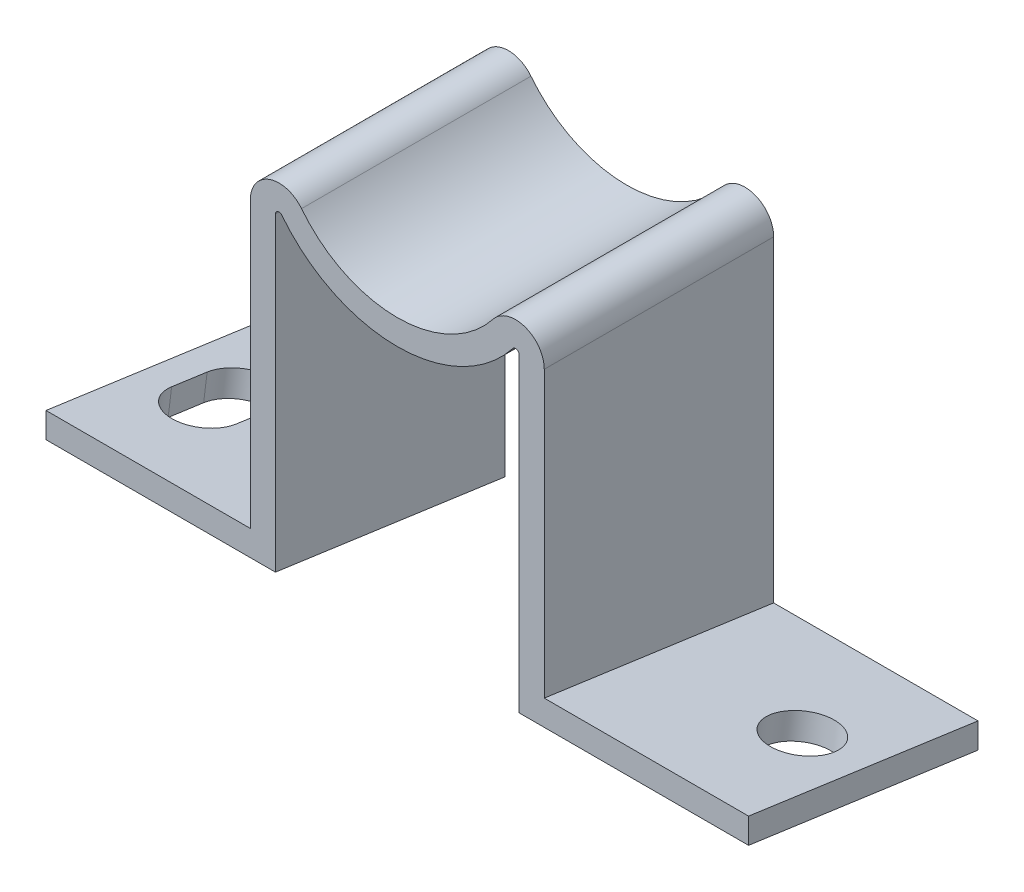
from build123d import *

# Parameters (mm, degrees)
EXTRUDE_1_DEPTH     = 16
CUT_EXTRUDE_1_DEPTH = 50
EXTRUDE_2_DEPTH     = 28.5
SKETCH_4_R          = 4.5
CUT_EXTRUDE_2_DEPTH = 28.5


with BuildPart() as part:
    # 草图1 → 凸台-拉伸1 (new, symmetric)
    with BuildSketch(Plane.XY):
        with BuildLine():
            Line((-17, -12.990381057), (-17, -66.86388681))
            Line((-17, -66.86388681), (-20.5, -66.86388681))
            Line((-20.5, -66.86388681), (-20.5, -12.990381057))
            ThreePointArc((-20.5, -12.990381057), (-17.809307341, -9.210736327), (-13.357142857, -10.51602276))
            ThreePointArc((-13.357142857, -10.51602276), (0, -17), (13.357142857, -10.51602276))
            ThreePointArc((13.357142857, -10.51602276), (17.809307341, -9.210736327), (20.5, -12.990381057))
            Line((20.5, -12.990381057), (20.5, -66.86388681))
            Line((20.5, -66.86388681), (17, -66.86388681))
            Line((17, -66.86388681), (17, -12.990381057))
            ThreePointArc((17, -12.990381057), (16.663663418, -12.517925466), (16.107142857, -12.68108627))
            ThreePointArc((16.107142857, -12.68108627), (0, -20.5), (-16.107142857, -12.68108627))
            ThreePointArc((-16.107142857, -12.68108627), (-16.663663418, -12.517925466), (-17, -12.990381057))
        make_face()
    extrude(amount=EXTRUDE_1_DEPTH, both=True)

    # 草图2 → 切除-拉伸1 (cut, symmetric)
    with BuildSketch(Plane(origin=(0, 0, 0), x_dir=(0, 0, -1), z_dir=(1, 0, 0))):
        Polygon((16, -60.748653355), (-16, -56.251346645), (-16, -66.86388681), (16, -66.86388681), align=None)
    extrude(amount=CUT_EXTRUDE_1_DEPTH, both=True, mode=Mode.SUBTRACT)

    # 草图3 → 凸台-拉伸2 (add)
    with BuildSketch(Plane.ZY.offset(20.5)):
        Polygon((-16, -60.748653355), (16, -56.251346645), (16, -52.716950141), (-16, -57.214256851), align=None)
    extrude_2 = extrude(amount=EXTRUDE_2_DEPTH)

    # 镜向1: 凸台-拉伸2 across plane
    add(extrude_2.mirror(Plane(origin=(0, 0, 0), x_dir=(0, 0, 1), z_dir=(1, 0, 0))))

    # 草图4 → 切除-拉伸2 (cut)
    with BuildSketch(Plane(origin=(0, -53.900966366, 7.575286804), x_dir=(1, 0, 0), z_dir=(0, 0.9902680687415715, -0.13917310096005808))):
        with Locations(Location((40.5, 7.649733485, 0), (0, 0, 270))):
            Circle(SKETCH_4_R)
        with BuildLine():
            Line((-36, 10.149733485), (-36, 5.149733485))
            ThreePointArc((-36, 5.149733485), (-40.5, 0.649733485), (-45, 5.149733485))
            Line((-45, 5.149733485), (-45, 10.149733485))
            ThreePointArc((-45, 10.149733485), (-40.5, 14.649733485), (-36, 10.149733485))
        make_face()
    extrude(amount=-CUT_EXTRUDE_2_DEPTH, mode=Mode.SUBTRACT)


solid = part.part
